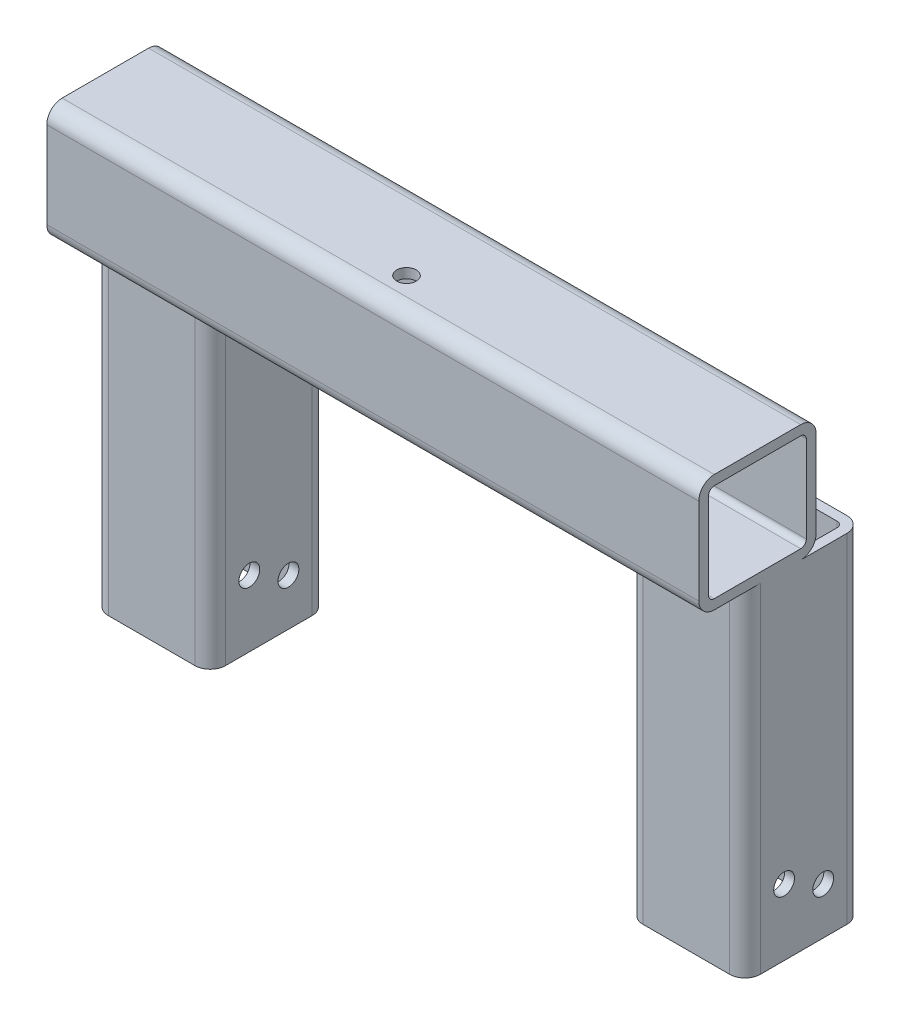
from build123d import *

# Parameters (mm, degrees)
BOSS_EXTRUDE1_DEPTH     = 110
BOSS_EXTRUDE2_START     = -105.9
BOSS_EXTRUDE2_DEPTH     = 211.8
CUT_EXTRUDE1_REACH      = 226.526
SKETCH3_R               = 3.175
F_1_4_CLEARANCE_HOLE1_D = 6.7564


with BuildPart() as part:
    # Sketch1 → Boss-Extrude1 (new body)
    with BuildSketch(Plane(origin=(0, 0, 0), x_dir=(1, 0, 0), z_dir=(0, 1, 0))):
        with BuildLine():
            Line((-14.05, 19.05), (14.05, 19.05))
            ThreePointArc((14.05, 19.05), (17.585533906, 17.585533906), (19.05, 14.05))
            Line((19.05, 14.05), (19.05, -14.05))
            ThreePointArc((19.05, -14.05), (17.585533906, -17.585533906), (14.05, -19.05))
            Line((14.05, -19.05), (-14.05, -19.05))
            ThreePointArc((-14.05, -19.05), (-17.585533906, -17.585533906), (-19.05, -14.05))
            Line((-19.05, -14.05), (-19.05, 14.05))
            ThreePointArc((-19.05, 14.05), (-17.585533906, 17.585533906), (-14.05, 19.05))
        make_face()
        with BuildLine():
            Line((-15.875, 14.05), (-15.875, -14.05))
            ThreePointArc((-15.875, -14.05), (-15.340469876, -15.340469876), (-14.05, -15.875))
            Line((-14.05, -15.875), (14.05, -15.875))
            ThreePointArc((14.05, -15.875), (15.340469876, -15.340469876), (15.875, -14.05))
            Line((15.875, -14.05), (15.875, 14.05))
            ThreePointArc((15.875, 14.05), (15.340469876, 15.340469876), (14.05, 15.875))
            Line((14.05, 15.875), (-14.05, 15.875))
            ThreePointArc((-14.05, 15.875), (-15.340469876, 15.340469876), (-15.875, 14.05))
        make_face(mode=Mode.SUBTRACT)
    extrude(amount=BOSS_EXTRUDE1_DEPTH)


with BuildPart() as body_2:
    # Mirror2: mirrored copy
    add(part.part.mirror(Plane(origin=(86.85, 0, 0), x_dir=(0, 0, 1), z_dir=(1, 0, 0))))


with BuildPart() as part_1:
    add(part.part)

    add(body_2.part)  # Boss-Extrude2 merges body 2
    # Sketch2 → Boss-Extrude2 (add)
    with BuildSketch(Plane(origin=(86.85, 0, 0), x_dir=(0, 0, -1), z_dir=(1, 0, 0)).offset(BOSS_EXTRUDE2_START)):
        with BuildLine():
            Line((-29.05, 148.1), (-0.95, 148.1))
            ThreePointArc((-0.95, 148.1), (2.585533906, 146.635533906), (4.05, 143.1))
            Line((4.05, 143.1), (4.05, 115))
            ThreePointArc((4.05, 115), (2.585533906, 111.464466094), (-0.95, 110))
            Line((-0.95, 110), (-29.05, 110))
            ThreePointArc((-29.05, 110), (-32.585533906, 111.464466094), (-34.05, 115))
            Line((-34.05, 115), (-34.05, 143.1))
            ThreePointArc((-34.05, 143.1), (-32.585533906, 146.635533906), (-29.05, 148.1))
        make_face()
        with BuildLine():
            Line((-30.875, 143.1), (-30.875, 115))
            ThreePointArc((-30.875, 115), (-30.340469876, 113.709530124), (-29.05, 113.175))
            Line((-29.05, 113.175), (-0.95, 113.175))
            ThreePointArc((-0.95, 113.175), (0.340469876, 113.709530124), (0.875, 115))
            Line((0.875, 115), (0.875, 143.1))
            ThreePointArc((0.875, 143.1), (0.340469876, 144.390469876), (-0.95, 144.925))
            Line((-0.95, 144.925), (-29.05, 144.925))
            ThreePointArc((-29.05, 144.925), (-30.340469876, 144.390469876), (-30.875, 143.1))
        make_face(mode=Mode.SUBTRACT)
    extrude(amount=BOSS_EXTRUDE2_DEPTH)

    # Cut-Extrude1: up to this face of the body (flat: up to its plane)
    cut_extrude1_end = Plane(part_1.part.faces().sort_by_distance((86.85, 148.1, 15))[0])
    # Sketch3 → Cut-Extrude1 (cut, up to the picked face)
    with BuildSketch(Plane.XZ.offset(-110), mode=Mode.PRIVATE) as cut_extrude1_sk1:
        with Locations(Location((86.8, 23.050000029, 0), (0, 0, 270))):
            Circle(SKETCH3_R)
    cut_extrude1_tool1 = split(extrude(cut_extrude1_sk1.sketch, amount=-CUT_EXTRUDE1_REACH, mode=Mode.PRIVATE), bisect_by=cut_extrude1_end, keep=Keep.BOTH, mode=Mode.PRIVATE)
    add(cut_extrude1_tool1.solids().sort_by(Axis((86.8, 110, 23.05), (0, 1, 0)))[0], mode=Mode.SUBTRACT)

    # 1/4 Clearance Hole1 (through all)
    with Locations(Plane.ZY.offset(19.05)):
        with Locations((-6.35, 15.24), (6.35, 21.59)):
            Hole(F_1_4_CLEARANCE_HOLE1_D / 2)


solid = part_1.part
